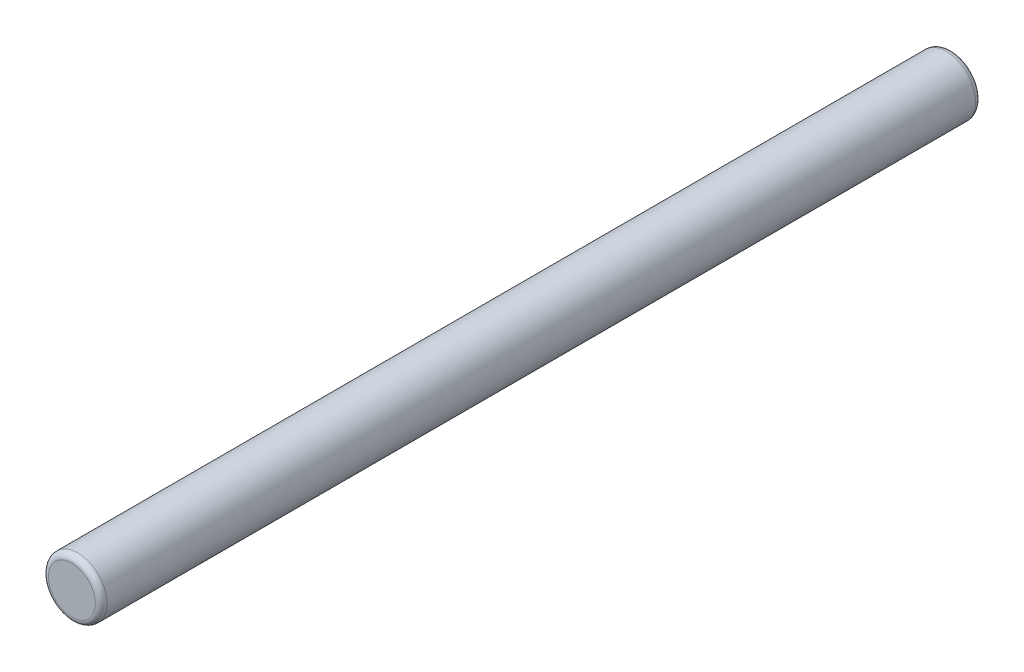
from build123d import *

# Parameters (mm, degrees)
ESQUISSE1_R      = 1
EXTRUSION1_DEPTH = 30
CONG_1_R         = 0.2


with BuildPart() as part:
    # Esquisse1 → Extrusion1 (new body)
    with BuildSketch(Plane.XY):
        Circle(ESQUISSE1_R)
    extrude(amount=EXTRUSION1_DEPTH)

    # Congé1
    cong_1_edges = [part.edges().sort_by_distance(p)[0] for p in [
        (-1, 0, 0),
        (-1, 0, 30),
    ]]
    fillet(cong_1_edges, radius=CONG_1_R)


solid = part.part
